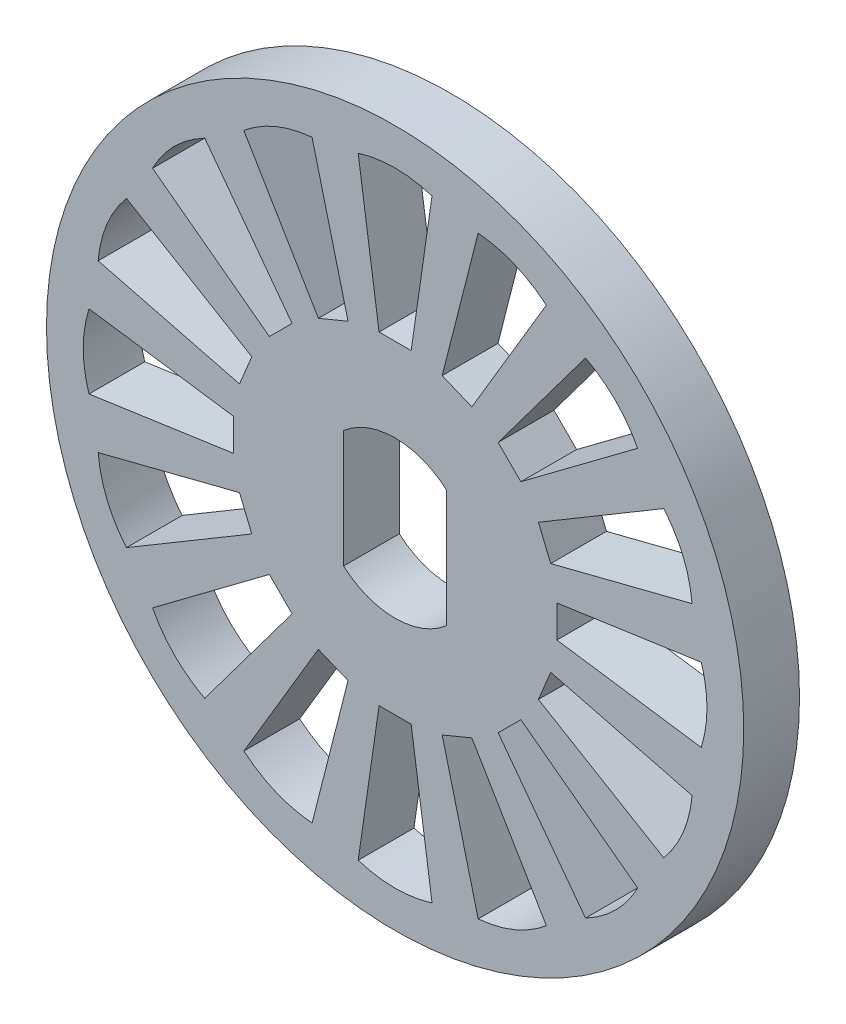
from build123d import *

# Parameters (mm, degrees)
SKETCH1_R           = 12.5
BOSS_EXTRUDE1_DEPTH = 2
CUT_EXTRUDE1_DEPTH  = 2
CUT_EXTRUDE2_DEPTH  = 2


with BuildPart() as part:
    # Sketch1 → Boss-Extrude1 (new body)
    with BuildSketch(Plane.XY):
        Circle(SKETCH1_R)
    extrude(amount=BOSS_EXTRUDE1_DEPTH)

    # Sketch2 → Cut-Extrude1 (cut)
    with BuildSketch(Plane.XY.offset(2)):
        with BuildLine():
            Line((1.85, 2.101784956), (1.85, -2.101784956))
            ThreePointArc((1.85, -2.101784956), (0, -2.8), (-1.85, -2.101784956))
            Line((-1.85, -2.101784956), (-1.85, 2.101784956))
            ThreePointArc((-1.85, 2.101784956), (0, 2.8), (1.85, 2.101784956))
        make_face()
    extrude(amount=-CUT_EXTRUDE1_DEPTH, mode=Mode.SUBTRACT)

    # Sketch3 → Cut-Extrude2 (cut)
    with BuildSketch(Plane.XY.offset(2)):
        with BuildLine():
            Line((-0.575541349, 5.8), (0.575541349, 5.8))
            Line((0.575541349, 5.8), (1.323383427, 10.975313802))
            add(Edge.make_bspline(
                [(-1.323383427, 10.975313802), (0, 11.388369724), (1.323383427, 10.975313802)],
                knots=[0, 0, 0, 1, 1, 1], degree=2))
            Line((-1.323383427, 10.975313802), (-0.575541349, 5.8))
        make_face()
        with BuildLine():
            Line((2.75129478, 5.13825115), (5.422717619, 9.633430872))
            add(Edge.make_bspline(
                [(2.977423895, 10.646304697), (4.358140415, 10.521481696), (5.422717619, 9.633430872)],
                knots=[0, 0, 0, 1, 1, 1], degree=2))
            Line((2.977423895, 10.646304697), (1.687833035, 5.578751427))
            Line((1.687833035, 5.578751427), (2.75129478, 5.13825115))
        make_face()
        with BuildLine():
            Line((4.508188522, 3.69425014), (8.69649221, 6.82494542))
            add(Edge.make_bspline(
                [(6.82494542, 8.69649221), (8.052793458, 8.052793458), (8.69649221, 6.82494542)],
                knots=[0, 0, 0, 1, 1, 1], degree=2))
            Line((6.82494542, 8.69649221), (3.69425014, 4.508188522))
            Line((3.69425014, 4.508188522), (4.508188522, 3.69425014))
        make_face()
        with BuildLine():
            Line((5.578751427, 1.687833035), (10.646304697, 2.977423895))
            add(Edge.make_bspline(
                [(9.633430872, 5.422717619), (10.521481696, 4.358140415), (10.646304697, 2.977423895)],
                knots=[0, 0, 0, 1, 1, 1], degree=2))
            Line((9.633430872, 5.422717619), (5.13825115, 2.75129478))
            Line((5.13825115, 2.75129478), (5.578751427, 1.687833035))
        make_face()
        with BuildLine():
            Line((5.8, -0.575541349), (10.975313802, -1.323383427))
            add(Edge.make_bspline(
                [(10.975313802, 1.323383427), (11.388369724, 0), (10.975313802, -1.323383427)],
                knots=[0, 0, 0, 1, 1, 1], degree=2))
            Line((10.975313802, 1.323383427), (5.8, 0.575541349))
            Line((5.8, 0.575541349), (5.8, -0.575541349))
        make_face()
        with BuildLine():
            Line((5.13825115, -2.75129478), (9.633430872, -5.422717619))
            add(Edge.make_bspline(
                [(10.646304697, -2.977423895), (10.521481696, -4.358140415), (9.633430872, -5.422717619)],
                knots=[0, 0, 0, 1, 1, 1], degree=2))
            Line((10.646304697, -2.977423895), (5.578751427, -1.687833035))
            Line((5.578751427, -1.687833035), (5.13825115, -2.75129478))
        make_face()
        with BuildLine():
            Line((3.69425014, -4.508188522), (6.82494542, -8.69649221))
            add(Edge.make_bspline(
                [(8.69649221, -6.82494542), (8.052793458, -8.052793458), (6.82494542, -8.69649221)],
                knots=[0, 0, 0, 1, 1, 1], degree=2))
            Line((8.69649221, -6.82494542), (4.508188522, -3.69425014))
            Line((4.508188522, -3.69425014), (3.69425014, -4.508188522))
        make_face()
        with BuildLine():
            Line((1.687833035, -5.578751427), (2.977423895, -10.646304697))
            add(Edge.make_bspline(
                [(5.422717619, -9.633430872), (4.358140415, -10.521481696), (2.977423895, -10.646304697)],
                knots=[0, 0, 0, 1, 1, 1], degree=2))
            Line((5.422717619, -9.633430872), (2.75129478, -5.13825115))
            Line((2.75129478, -5.13825115), (1.687833035, -5.578751427))
        make_face()
        with BuildLine():
            Line((-0.575541349, -5.8), (-1.323383427, -10.975313802))
            add(Edge.make_bspline(
                [(1.323383427, -10.975313802), (0, -11.388369724), (-1.323383427, -10.975313802)],
                knots=[0, 0, 0, 1, 1, 1], degree=2))
            Line((1.323383427, -10.975313802), (0.575541349, -5.8))
            Line((0.575541349, -5.8), (-0.575541349, -5.8))
        make_face()
        with BuildLine():
            Line((-2.75129478, -5.13825115), (-5.422717619, -9.633430872))
            add(Edge.make_bspline(
                [(-2.977423895, -10.646304697), (-4.358140415, -10.521481696), (-5.422717619, -9.633430872)],
                knots=[0, 0, 0, 1, 1, 1], degree=2))
            Line((-2.977423895, -10.646304697), (-1.687833035, -5.578751427))
            Line((-1.687833035, -5.578751427), (-2.75129478, -5.13825115))
        make_face()
        with BuildLine():
            Line((-4.508188522, -3.69425014), (-8.69649221, -6.82494542))
            add(Edge.make_bspline(
                [(-6.82494542, -8.69649221), (-8.052793458, -8.052793458), (-8.69649221, -6.82494542)],
                knots=[0, 0, 0, 1, 1, 1], degree=2))
            Line((-6.82494542, -8.69649221), (-3.69425014, -4.508188522))
            Line((-3.69425014, -4.508188522), (-4.508188522, -3.69425014))
        make_face()
        with BuildLine():
            Line((-5.578751427, -1.687833035), (-10.646304697, -2.977423895))
            add(Edge.make_bspline(
                [(-9.633430872, -5.422717619), (-10.521481696, -4.358140415), (-10.646304697, -2.977423895)],
                knots=[0, 0, 0, 1, 1, 1], degree=2))
            Line((-9.633430872, -5.422717619), (-5.13825115, -2.75129478))
            Line((-5.13825115, -2.75129478), (-5.578751427, -1.687833035))
        make_face()
        with BuildLine():
            Line((-5.8, 0.575541349), (-10.975313802, 1.323383427))
            add(Edge.make_bspline(
                [(-10.975313802, -1.323383427), (-11.388369724, 0), (-10.975313802, 1.323383427)],
                knots=[0, 0, 0, 1, 1, 1], degree=2))
            Line((-10.975313802, -1.323383427), (-5.8, -0.575541349))
            Line((-5.8, -0.575541349), (-5.8, 0.575541349))
        make_face()
        with BuildLine():
            Line((-5.13825115, 2.75129478), (-9.633430872, 5.422717619))
            add(Edge.make_bspline(
                [(-10.646304697, 2.977423895), (-10.521481696, 4.358140415), (-9.633430872, 5.422717619)],
                knots=[0, 0, 0, 1, 1, 1], degree=2))
            Line((-10.646304697, 2.977423895), (-5.578751427, 1.687833035))
            Line((-5.578751427, 1.687833035), (-5.13825115, 2.75129478))
        make_face()
        with BuildLine():
            Line((-3.69425014, 4.508188522), (-6.82494542, 8.69649221))
            add(Edge.make_bspline(
                [(-8.69649221, 6.82494542), (-8.052793458, 8.052793458), (-6.82494542, 8.69649221)],
                knots=[0, 0, 0, 1, 1, 1], degree=2))
            Line((-8.69649221, 6.82494542), (-4.508188522, 3.69425014))
            Line((-4.508188522, 3.69425014), (-3.69425014, 4.508188522))
        make_face()
        with BuildLine():
            Line((-1.687833035, 5.578751427), (-2.977423895, 10.646304697))
            add(Edge.make_bspline(
                [(-5.422717619, 9.633430872), (-4.358140415, 10.521481696), (-2.977423895, 10.646304697)],
                knots=[0, 0, 0, 1, 1, 1], degree=2))
            Line((-5.422717619, 9.633430872), (-2.75129478, 5.13825115))
            Line((-2.75129478, 5.13825115), (-1.687833035, 5.578751427))
        make_face()
    extrude(amount=-CUT_EXTRUDE2_DEPTH, mode=Mode.SUBTRACT)


solid = part.part
